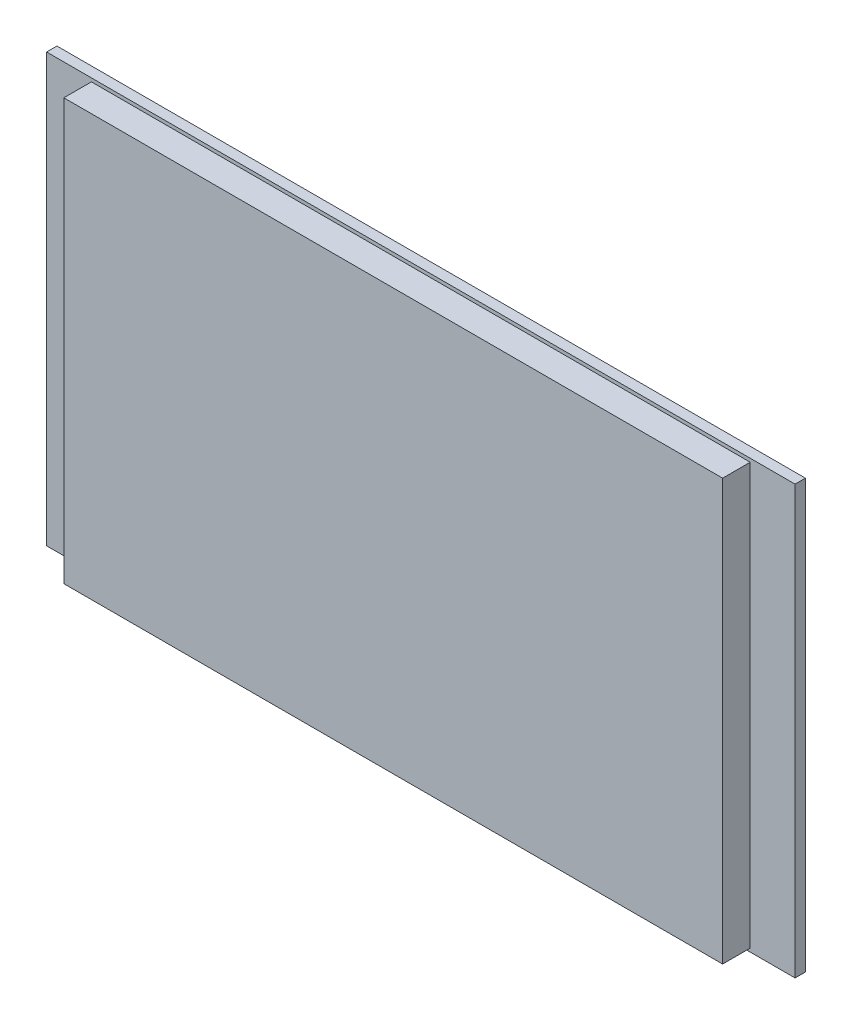
from build123d import *

# Parameters (mm, degrees)
ESQUISSE1_W        = 95.5
ESQUISSE1_H        = 61
BOSS_EXTRU_1_DEPTH = 4
ESQUISSE2_W        = 108.5
ESQUISSE2_H        = 62
BOSS_EXTRU_2_DEPTH = 1.5
ESQUISSE3_W        = 2.5
ESQUISSE3_H        = 35.5
BOSS_EXTRU_3_DEPTH = 3
ESQUISSE4_W        = 0.65
ESQUISSE4_H        = 0.65
BOSS_EXTRU_4_DEPTH = 5.5


with BuildPart() as part:
    # Esquisse1 → Boss.-Extru.1 (new body)
    with BuildSketch(Plane.XY):
        Rectangle(ESQUISSE1_W, ESQUISSE1_H)
    extrude(amount=BOSS_EXTRU_1_DEPTH)

    # Esquisse2 → Boss.-Extru.2 (add)
    with BuildSketch(Plane(origin=(0, 0, 0), x_dir=(-1, 0, 0), z_dir=(0, 0, -1))):
        Rectangle(ESQUISSE2_W, ESQUISSE2_H)
    extrude(amount=BOSS_EXTRU_2_DEPTH)

    # Esquisse3 → Boss.-Extru.3 (add)
    with BuildSketch(Plane(origin=(0, 0, -1.5), x_dir=(-1, 0, 0), z_dir=(0, 0, -1))):
        with Locations((52.5, 0)):
            Rectangle(ESQUISSE3_W, ESQUISSE3_H)
    extrude(amount=BOSS_EXTRU_3_DEPTH)

    # Esquisse4 → Boss.-Extru.4 (add)
    with BuildSketch(Plane(origin=(0, 0, -4.5), x_dir=(-1, 0, 0), z_dir=(0, 0, -1))):
        with Locations((52.5, 16.775)):
            Rectangle(ESQUISSE4_W, ESQUISSE4_H)
        with Locations((52.5, 14.275)):
            Rectangle(ESQUISSE4_W, ESQUISSE4_H)
        with Locations((52.5, 11.775)):
            Rectangle(ESQUISSE4_W, ESQUISSE4_H)
        with Locations((52.5, 9.275)):
            Rectangle(ESQUISSE4_W, ESQUISSE4_H)
        with Locations((52.5, 6.775)):
            Rectangle(ESQUISSE4_W, ESQUISSE4_H)
        with Locations((52.5, 4.275)):
            Rectangle(ESQUISSE4_W, ESQUISSE4_H)
        with Locations((52.5, 1.775)):
            Rectangle(ESQUISSE4_W, ESQUISSE4_H)
        with Locations((52.5, -0.725)):
            Rectangle(ESQUISSE4_W, ESQUISSE4_H)
        with Locations((52.5, -3.225)):
            Rectangle(ESQUISSE4_W, ESQUISSE4_H)
        with Locations((52.5, -5.725)):
            Rectangle(ESQUISSE4_W, ESQUISSE4_H)
        with Locations((52.5, -8.225)):
            Rectangle(ESQUISSE4_W, ESQUISSE4_H)
        with Locations((52.5, -10.725)):
            Rectangle(ESQUISSE4_W, ESQUISSE4_H)
        with Locations((52.5, -13.225)):
            Rectangle(ESQUISSE4_W, ESQUISSE4_H)
        with Locations((52.5, -15.725)):
            Rectangle(ESQUISSE4_W, ESQUISSE4_H)
    extrude(amount=BOSS_EXTRU_4_DEPTH)


solid = part.part
